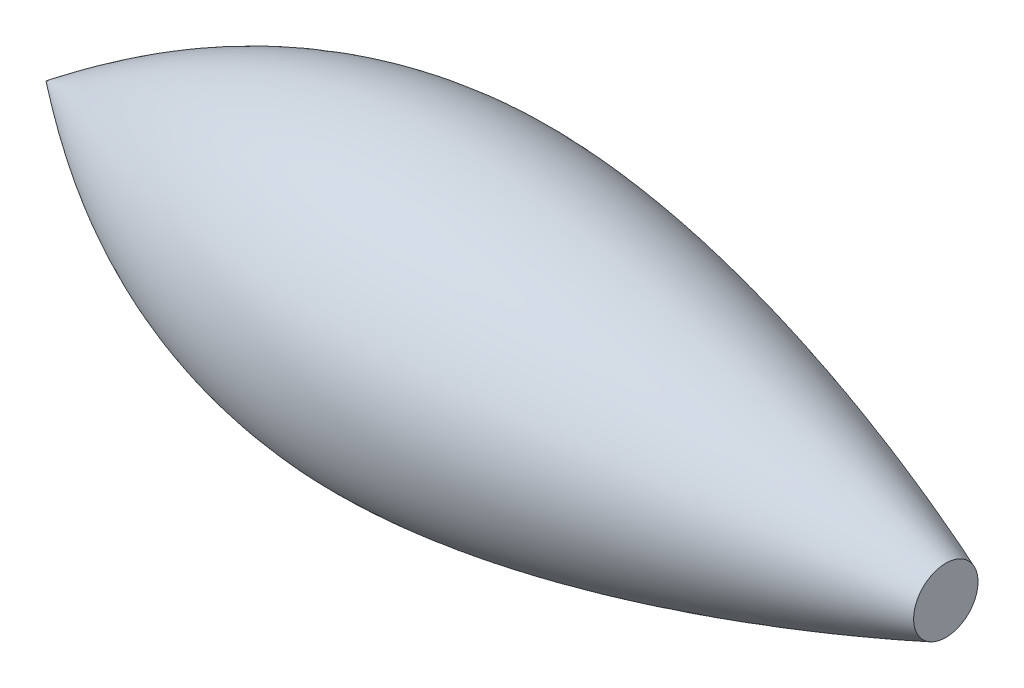
from build123d import *

# Parameters (mm, degrees)
SCALE2_SCALE = 692.7273


with BuildPart() as part:
    # Sketch1 → Revolve1 (revolve)
    with BuildSketch(Plane.XY):
        with BuildLine():
            Line((5.985907929, 0), (5.985907929, 0.214225327))
            add(Edge.make_bspline(
                [(0, 0), (0.539322461, 0.410294972), (2.17708693, 1.520061975), (5.175084695, 0.535736501), (5.985907929, 0.214225327)],
                knots=[0, 0, 0, 0, 0.517108718, 1, 1, 1, 1], degree=3))
            Line((0, 0), (5.985907929, 0))
        make_face()
    revolve(axis=Axis((0, 0, 0), (1, 0, 0)))


with BuildPart() as part_1:
    # Scale2: scaled about (0, 0, 0)
    add(part.part.scale(SCALE2_SCALE))


solid = part_1.part
